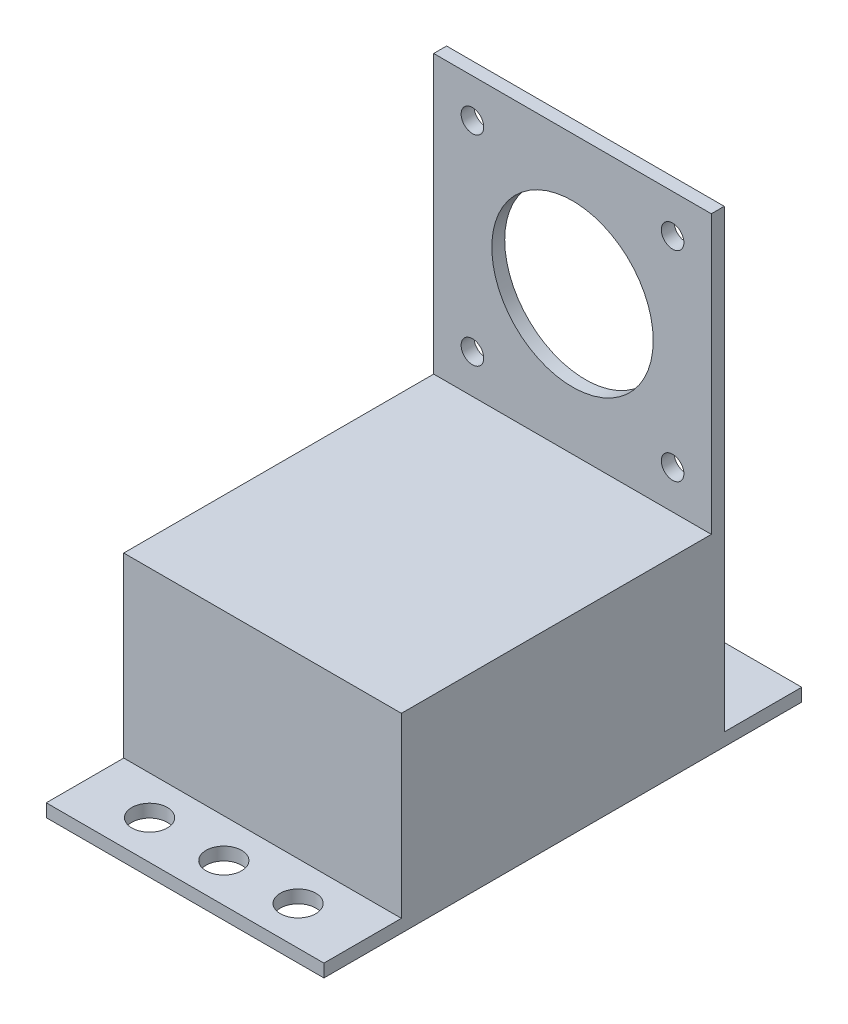
from build123d import *

# Parameters (mm, degrees)
SKETCH1_W           = 43
SKETCH1_H           = 2
BOSS_EXTRUDE1_DEPTH = 43
SKETCH1_3_W         = 43
SKETCH1_3_H         = 74
BOSS_EXTRUDE2_DEPTH = 29.5
CUT_EXTRUDE1_REACH  = 78.885
SKETCH2_R           = 12.5
SKETCH2_R_2         = 1.75
CUT_EXTRUDE2_REACH  = 62.665
SKETCH1_4_R         = 2.75
LPATTERN1_COUNT     = 2
LPATTERN1_PITCH     = 11.5
LPATTERN1_COL_COUNT = 2
LPATTERN1_COL_PITCH = 11.5
SKETCH3_W           = 43
SKETCH3_H           = 12
CUT_EXTRUDE3_DEPTH  = 27.5


with BuildPart() as part:
    # Sketch1 → Boss-Extrude1 (new body)
    with BuildSketch(Plane(origin=(0, 0, 0), x_dir=(1, 0, 0), z_dir=(0, 1, 0))):
        with Locations((0, 24)):
            Rectangle(SKETCH1_W, SKETCH1_H)
    extrude(amount=BOSS_EXTRUDE1_DEPTH)

    # Sketch1<3> → Boss-Extrude2 (add)
    with BuildSketch(Plane(origin=(0, 0, 0), x_dir=(1, 0, 0), z_dir=(0, 1, 0))):
        Rectangle(SKETCH1_3_W, SKETCH1_3_H)
    extrude(amount=-BOSS_EXTRUDE2_DEPTH)

    # Sketch2 → Cut-Extrude1 (cut, up to next)
    with BuildSketch(Plane.XY.offset(-23), mode=Mode.PRIVATE) as cut_extrude1_sk1:
        with Locations((0, 21.5)):
            Circle(SKETCH2_R)
    cut_extrude1_tool1 = extrude(cut_extrude1_sk1.sketch, amount=-CUT_EXTRUDE1_REACH, mode=Mode.PRIVATE) & part.part
    # Sketch2 → Cut-Extrude1 (cut, up to next)
    with BuildSketch(Plane.XY.offset(-23), mode=Mode.PRIVATE) as cut_extrude1_sk2:
        with Locations((-15.5, 37)):
            Circle(SKETCH2_R_2)
    cut_extrude1_tool2 = extrude(cut_extrude1_sk2.sketch, amount=-CUT_EXTRUDE1_REACH, mode=Mode.PRIVATE) & part.part
    # Sketch2 → Cut-Extrude1 (cut, up to next)
    with BuildSketch(Plane.XY.offset(-23), mode=Mode.PRIVATE) as cut_extrude1_sk3:
        with Locations((15.5, 37)):
            Circle(SKETCH2_R_2)
    cut_extrude1_tool3 = extrude(cut_extrude1_sk3.sketch, amount=-CUT_EXTRUDE1_REACH, mode=Mode.PRIVATE) & part.part
    # Sketch2 → Cut-Extrude1 (cut, up to next)
    with BuildSketch(Plane.XY.offset(-23), mode=Mode.PRIVATE) as cut_extrude1_sk4:
        with Locations((15.5, 6)):
            Circle(SKETCH2_R_2)
    cut_extrude1_tool4 = extrude(cut_extrude1_sk4.sketch, amount=-CUT_EXTRUDE1_REACH, mode=Mode.PRIVATE) & part.part
    # Sketch2 → Cut-Extrude1 (cut, up to next)
    with BuildSketch(Plane.XY.offset(-23), mode=Mode.PRIVATE) as cut_extrude1_sk5:
        with Locations((-15.5, 6)):
            Circle(SKETCH2_R_2)
    cut_extrude1_tool5 = extrude(cut_extrude1_sk5.sketch, amount=-CUT_EXTRUDE1_REACH, mode=Mode.PRIVATE) & part.part
    add(cut_extrude1_tool1.solids().sort_by_distance((0, 21.5, -23))[0], mode=Mode.SUBTRACT)
    add(cut_extrude1_tool2.solids().sort_by_distance((-15.5, 37, -23))[0], mode=Mode.SUBTRACT)
    add(cut_extrude1_tool3.solids().sort_by_distance((15.5, 37, -23))[0], mode=Mode.SUBTRACT)
    add(cut_extrude1_tool4.solids().sort_by_distance((15.5, 6, -23))[0], mode=Mode.SUBTRACT)
    add(cut_extrude1_tool5.solids().sort_by_distance((-15.5, 6, -23))[0], mode=Mode.SUBTRACT)

    # Sketch1<4> → Cut-Extrude2 (cut, up to next)
    with BuildSketch(Plane(origin=(0, 0, 0), x_dir=(1, 0, 0), z_dir=(0, 1, 0)), mode=Mode.PRIVATE) as cut_extrude2_sk1:
        with Locations((0, 31)):
            Circle(SKETCH1_4_R)
    cut_extrude2_tool1 = extrude(cut_extrude2_sk1.sketch, amount=-CUT_EXTRUDE2_REACH, mode=Mode.PRIVATE) & part.part
    # Sketch1<4> → Cut-Extrude2 (cut, up to next)
    with BuildSketch(Plane(origin=(0, 0, 0), x_dir=(1, 0, 0), z_dir=(0, 1, 0)), mode=Mode.PRIVATE) as cut_extrude2_sk2:
        with Locations((0, -31)):
            Circle(SKETCH1_4_R)
    cut_extrude2_tool2 = extrude(cut_extrude2_sk2.sketch, amount=-CUT_EXTRUDE2_REACH, mode=Mode.PRIVATE) & part.part
    cut_extrude2_1 = cut_extrude2_tool1.solids().sort_by_distance((0, 0, -31))[0]
    add(cut_extrude2_1, mode=Mode.SUBTRACT)
    cut_extrude2_2 = cut_extrude2_tool2.solids().sort_by_distance((0, 0, 31))[0]
    add(cut_extrude2_2, mode=Mode.SUBTRACT)
    cut_extrude2 = cut_extrude2_1 + cut_extrude2_2  # Cut-Extrude2 as one shape, for the pattern or mirror that repeats it

    # LPattern1: Cut-Extrude2 ×2
    with Locations(*[(i * LPATTERN1_PITCH, 0, 0) for i in range(1, LPATTERN1_COUNT)]):
        add(cut_extrude2, mode=Mode.SUBTRACT)

    # LPattern1 col: Cut-Extrude2 ×2
    with Locations(*[(-i * LPATTERN1_COL_PITCH, 0, 0) for i in range(1, LPATTERN1_COL_COUNT)]):
        add(cut_extrude2, mode=Mode.SUBTRACT)

    # Sketch3 → Cut-Extrude3 (cut)
    with BuildSketch(Plane(origin=(0, 0, 0), x_dir=(1, 0, 0), z_dir=(0, 1, 0))):
        with Locations((0, -31)):
            Rectangle(SKETCH3_W, SKETCH3_H)
        with Locations((0, 31)):
            Rectangle(SKETCH3_W, SKETCH3_H)
    extrude(amount=-CUT_EXTRUDE3_DEPTH, mode=Mode.SUBTRACT)


solid = part.part
